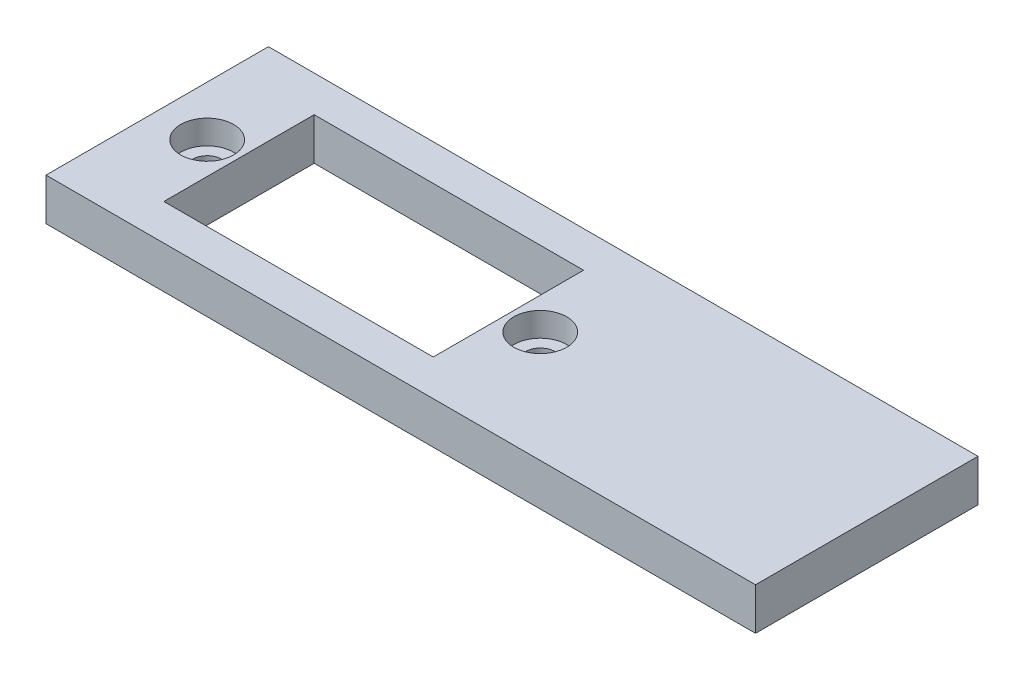
from build123d import *

# Parameters (mm, degrees)
SKETCH_1_W                   = 22.4
SKETCH_1_H                   = 12.5
EXTRUDE_1_DEPTH              = 3.5
HOLE_WIZARD_M2_2_D           = 2.4
HOLE_WIZARD_M2_2_CBORE_D     = 4.4
HOLE_WIZARD_M2_2_CBORE_DEPTH = 2


with BuildPart() as part:
    # 草图1 → 凸台-拉伸1 (new body)
    with BuildSketch(Plane(origin=(0, 0, 0), x_dir=(1, 0, 0), z_dir=(0, 1, 0))):
        Polygon((-36, -9.25), (0, -9.25), (23, -9.25), (23, 9.25), (0, 9.25), (-36, 9.25), align=None)
        with Locations((-18, 0)):
            Rectangle(SKETCH_1_W, SKETCH_1_H, mode=Mode.SUBTRACT)
    extrude(amount=EXTRUDE_1_DEPTH)

    # M2 凹头盖螺钉的柱形沉头孔2 (through all)
    with Locations(Plane(origin=(-31.85, 3.5, 0), x_dir=(0, 0, 1), z_dir=(0, 1, 0))):
        with Locations((0, 0), (0, 27.7)):
            CounterBoreHole(HOLE_WIZARD_M2_2_D / 2, HOLE_WIZARD_M2_2_CBORE_D / 2, HOLE_WIZARD_M2_2_CBORE_DEPTH)


solid = part.part
